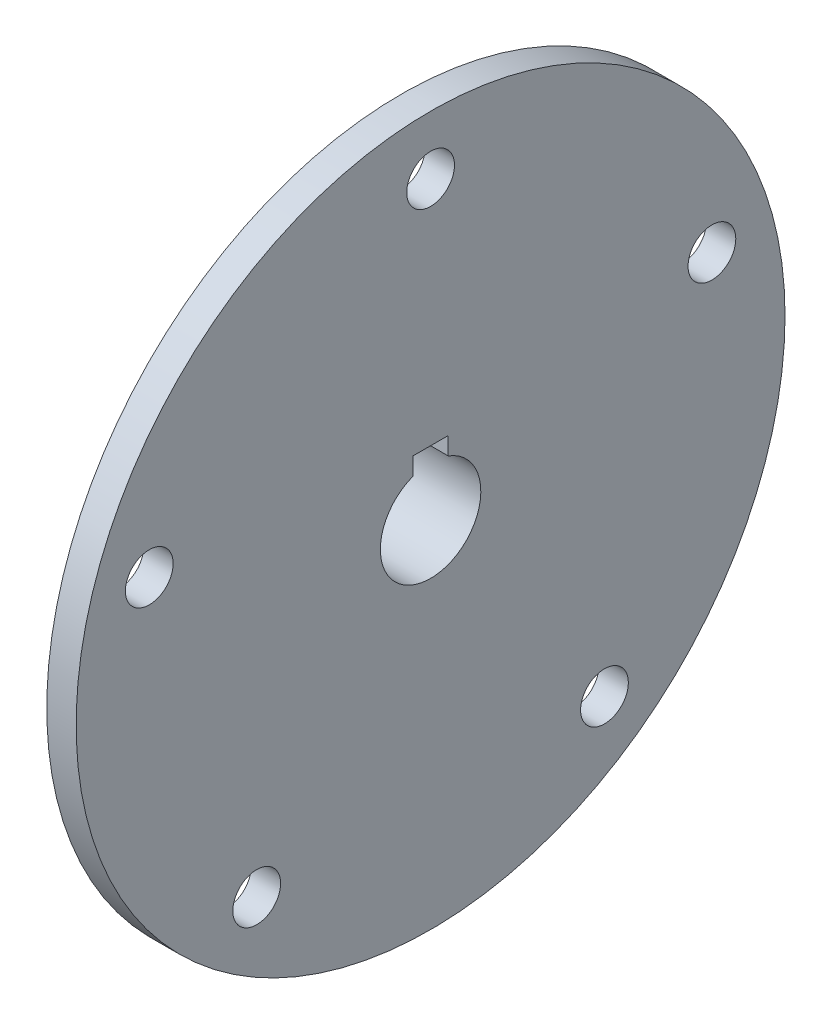
from build123d import *

# Parameters (mm, degrees)
SKETCH1_R           = 60.325
BOSS_EXTRUDE1_DEPTH = 5
SKETCH2_R           = 4.064
CUT_EXTRUDE1_DEPTH  = 86.458827806
SKETCH11_R          = 17.5
BOSS_EXTRUDE3_DEPTH = 30
CUT_EXTRUDE5_DEPTH  = 93.212858377


with BuildPart() as part:
    # Sketch1 → Boss-Extrude1 (new body)
    with BuildSketch(Plane(origin=(0, 0, 0), x_dir=(0, 0, -1), z_dir=(1, 0, 0))):
        Circle(SKETCH1_R)
    extrude(amount=-BOSS_EXTRUDE1_DEPTH)

    # Sketch2 → Cut-Extrude1 (cut, through all)
    with BuildSketch(Plane(origin=(0, 0, 0), x_dir=(0, 0, -1), z_dir=(1, 0, 0))):
        with Locations((0, 50.342959834)):
            Circle(SKETCH2_R)
        with Locations((47.879, 15.556830136)):
            Circle(SKETCH2_R)
        with Locations((29.590849347, -40.728310053)):
            Circle(SKETCH2_R)
        with Locations((-29.590849347, -40.728310053)):
            Circle(SKETCH2_R)
        with Locations((-47.879, 15.556830136)):
            Circle(SKETCH2_R)
    extrude(amount=-CUT_EXTRUDE1_DEPTH, mode=Mode.SUBTRACT)

    # Sketch11 → Boss-Extrude3 (add)
    with BuildSketch(Plane.ZY.offset(5)):
        with Locations(Location((0, 0, 0), (0, 0, 180))):
            Circle(SKETCH11_R)
    extrude(amount=BOSS_EXTRUDE3_DEPTH)

    # Sketch12 → Cut-Extrude5 (cut, through all)
    with BuildSketch(Plane.ZY.offset(35)):
        with BuildLine():
            Line((0, 11.006403687), (-3, 11.006403687))
            Line((-3, 11.006403687), (-3, 8.006403687))
            ThreePointArc((-3, 8.006403687), (0, -8.55), (3, 8.006403687))
            Line((3, 8.006403687), (3, 11.006403687))
            Line((3, 11.006403687), (0, 11.006403687))
        make_face()
    extrude(amount=-CUT_EXTRUDE5_DEPTH, mode=Mode.SUBTRACT)


solid = part.part
